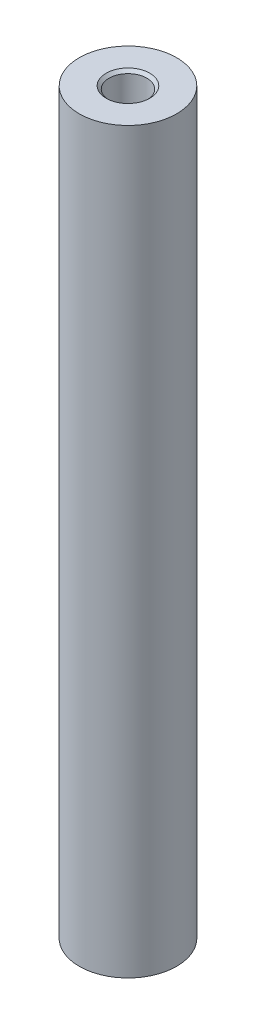
from build123d import *

# Parameters (mm, degrees)
SKETCH1_R           = 5.07
BOSS_EXTRUDE1_DEPTH = 76.9
SKETCH2_R           = 1.97
CUT_EXTRUDE1_DEPTH  = 15.2
CHAMFER2_SIZE       = 0.3
CUT_EXTRUDE2_START  = -15.2
SKETCH3_R           = 1.97
CUT_EXTRUDE2_DEPTH  = 15.2
CHAMFER3_SIZE       = 0.3


with BuildPart() as part:
    # Sketch1 → Boss-Extrude1 (new body)
    with BuildSketch(Plane(origin=(0, 0, 0), x_dir=(1, 0, 0), z_dir=(0, 1, 0))):
        with Locations(Location((0, 0, 0), (0, 0, 270))):
            Circle(SKETCH1_R)
    extrude(amount=BOSS_EXTRUDE1_DEPTH)

    # Sketch2 → Cut-Extrude1 (cut)
    with BuildSketch(Plane(origin=(0, 76.9, 0), x_dir=(1, 0, 0), z_dir=(0, 1, 0))):
        with Locations(Location((0, 0, 0), (0, 0, 270))):
            Circle(SKETCH2_R)
    extrude(amount=-CUT_EXTRUDE1_DEPTH, mode=Mode.SUBTRACT)

    # Chamfer2
    chamfer2_edges = [part.edges().sort_by_distance(p)[0] for p in [
        (0, 76.9, -1.97),
    ]]
    chamfer(chamfer2_edges, length=CHAMFER2_SIZE)

    # Sketch3 → Cut-Extrude2 (cut)
    with BuildSketch(Plane(origin=(0, 0, 0), x_dir=(-1, 0, 0), z_dir=(0, -1, 0)).offset(CUT_EXTRUDE2_START)):
        with Locations(Location((0, 0, 0), (0, 0, 270))):
            Circle(SKETCH3_R)
    extrude(amount=CUT_EXTRUDE2_DEPTH, mode=Mode.SUBTRACT)

    # Chamfer3
    chamfer3_edges = [part.edges().sort_by_distance(p)[0] for p in [
        (0, 0, -1.97),
    ]]
    chamfer(chamfer3_edges, length=CHAMFER3_SIZE)


solid = part.part
